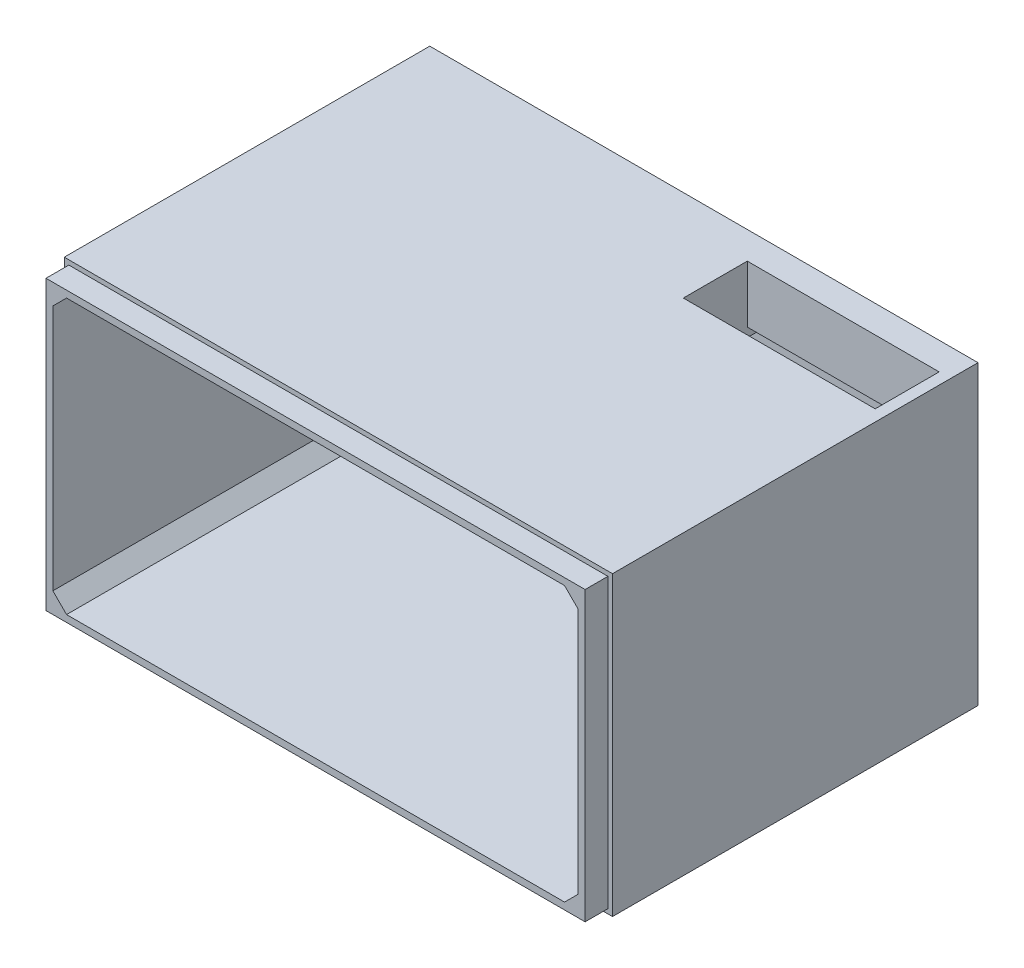
from build123d import *

# Parameters (mm, degrees)
SKETCH2_W           = 120
SKETCH2_H           = 65
BOSS_EXTRUDE1_DEPTH = 85
SKETCH3_W           = 115
SKETCH3_H           = 60
CUT_EXTRUDE1_DEPTH  = 82
SKETCH4_W           = 5
SKETCH4_H           = 65
CUT_EXTRUDE2_DEPTH  = 1
SKETCH5_W           = 119
SKETCH5_H           = 5
CUT_EXTRUDE3_DEPTH  = 1
BOSS_EXTRUDE2_DEPTH = 85
SKETCH9_W           = 5
SKETCH9_H           = 64
CUT_EXTRUDE4_DEPTH  = 1
SKETCH10_W          = 118
SKETCH10_H          = 5
CUT_EXTRUDE5_DEPTH  = 1
SKETCH11_W          = 42
SKETCH11_H          = 14
CUT_EXTRUDE6_DEPTH  = 10
SKETCH12_W          = 42.071261004
SKETCH12_H          = 10
BOSS_EXTRUDE3_DEPTH = 4
SKETCH13_W          = 2
SKETCH13_H          = 10
BOSS_EXTRUDE4_DEPTH = 17
SKETCH14_W          = 44.402934601
SKETCH14_H          = 10
BOSS_EXTRUDE5_DEPTH = 2
SKETCH15_W          = 44.064994884
SKETCH15_H          = 8
BOSS_EXTRUDE6_DEPTH = 2
SKETCH16_W          = 2
SKETCH16_H          = 2
BOSS_EXTRUDE7_DEPTH = 12
SKETCH17_W          = 17
SKETCH17_H          = 4
CUT_EXTRUDE7_DEPTH  = 5


with BuildPart() as part:
    # Sketch2 → Boss-Extrude1 (new body)
    with BuildSketch(Plane.XY):
        with Locations((60, 32.5)):
            Rectangle(SKETCH2_W, SKETCH2_H)
    extrude(amount=BOSS_EXTRUDE1_DEPTH)

    # Sketch3 → Cut-Extrude1 (cut)
    with BuildSketch(Plane.XY.offset(85)):
        with Locations((60, 32.5)):
            Rectangle(SKETCH3_W, SKETCH3_H)
    extrude(amount=-CUT_EXTRUDE1_DEPTH, mode=Mode.SUBTRACT)

    # Sketch4 → Cut-Extrude2 (cut)
    with BuildSketch(Plane.ZY):
        with Locations((82.5, 32.5)):
            Rectangle(SKETCH4_W, SKETCH4_H)
    extrude(amount=-CUT_EXTRUDE2_DEPTH, mode=Mode.SUBTRACT)

    # Sketch5 → Cut-Extrude3 (cut)
    with BuildSketch(Plane(origin=(0, 65, 0), x_dir=(1, 0, 0), z_dir=(0, 1, 0))):
        with Locations((60.5, -82.5)):
            Rectangle(SKETCH5_W, SKETCH5_H)
    extrude(amount=-CUT_EXTRUDE3_DEPTH, mode=Mode.SUBTRACT)

    # Sketch7 → Boss-Extrude2 (add)
    with BuildSketch(Plane.XY.offset(85)):
        Polygon((2.5, 62.5), (2.5, 59.5), (5.5, 62.5), align=None)
        Polygon((117.5, 62.5), (114.5, 62.5), (117.5, 59.5), align=None)
        Polygon((117.5, 5.5), (117.5, 2.5), (114.5, 2.5), align=None)
        Polygon((2.5, 2.5), (2.5, 5.5), (5.5, 2.5), align=None)
    extrude(amount=-BOSS_EXTRUDE2_DEPTH)

    # Sketch9 → Cut-Extrude4 (cut)
    with BuildSketch(Plane(origin=(120, 0, 0), x_dir=(0, 0, -1), z_dir=(1, 0, 0))):
        with Locations((-82.5, 32)):
            Rectangle(SKETCH9_W, SKETCH9_H)
    extrude(amount=-CUT_EXTRUDE4_DEPTH, mode=Mode.SUBTRACT)

    # Sketch10 → Cut-Extrude5 (cut)
    with BuildSketch(Plane.XZ):
        with Locations((60, 82.5)):
            Rectangle(SKETCH10_W, SKETCH10_H)
    extrude(amount=-CUT_EXTRUDE5_DEPTH, mode=Mode.SUBTRACT)

    # Sketch11 → Cut-Extrude6 (cut)
    with BuildSketch(Plane(origin=(0, 65, 0), x_dir=(1, 0, 0), z_dir=(0, 1, 0))):
        with Locations((96.5, -13)):
            Rectangle(SKETCH11_W, SKETCH11_H)
    extrude(amount=-CUT_EXTRUDE6_DEPTH, mode=Mode.SUBTRACT)

    # Sketch12 → Boss-Extrude3 (add)
    with BuildSketch(Plane.XY.offset(6)):
        with Locations((96.535630502, 57.5)):
            Rectangle(SKETCH12_W, SKETCH12_H)
    extrude(amount=-BOSS_EXTRUDE3_DEPTH)

    # Sketch13 → Boss-Extrude4 (add)
    with BuildSketch(Plane.XY.offset(3)):
        with Locations((74.5, 57.5)):
            Rectangle(SKETCH13_W, SKETCH13_H)
    extrude(amount=BOSS_EXTRUDE4_DEPTH)

    # Sketch14 → Boss-Extrude5 (add)
    with BuildSketch(Plane.XY.offset(20)):
        with Locations((95.701467301, 57.5)):
            Rectangle(SKETCH14_W, SKETCH14_H)
    extrude(amount=BOSS_EXTRUDE5_DEPTH)

    # Sketch15 → Boss-Extrude6 (add)
    with BuildSketch(Plane.XZ.offset(-52.5)):
        with Locations((95.532497442, 18)):
            Rectangle(SKETCH15_W, SKETCH15_H)
    extrude(amount=BOSS_EXTRUDE6_DEPTH)

    # Sketch16 → Boss-Extrude7 (add)
    with BuildSketch(Plane.XY.offset(3)):
        with Locations((74.5, 51.5)):
            Rectangle(SKETCH16_W, SKETCH16_H)
    extrude(amount=BOSS_EXTRUDE7_DEPTH)

    # Sketch17 → Cut-Extrude7 (cut)
    with BuildSketch(Plane(origin=(0, 52.5, 0), x_dir=(1, 0, 0), z_dir=(0, 1, 0))):
        with Locations((106.612593264, -16)):
            Rectangle(SKETCH17_W, SKETCH17_H)
    extrude(amount=-CUT_EXTRUDE7_DEPTH, mode=Mode.SUBTRACT)


solid = part.part
